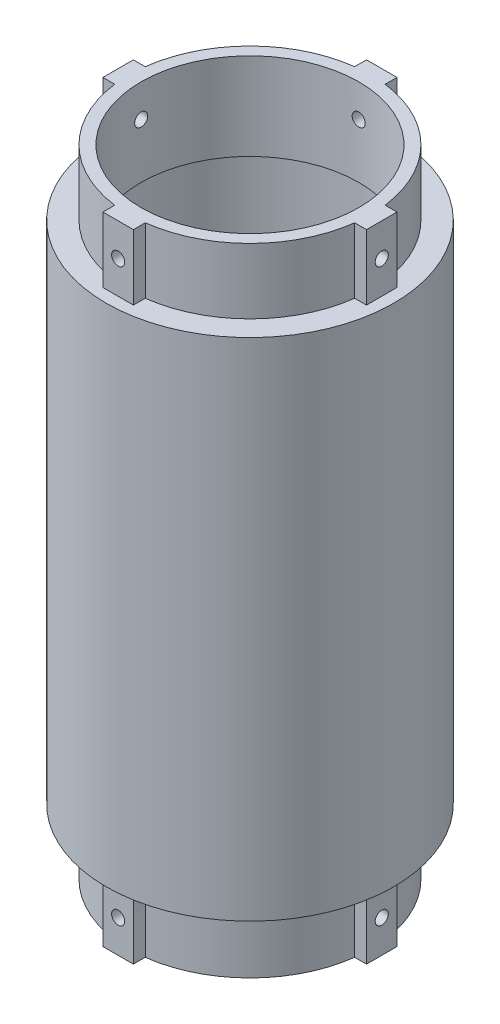
from build123d import *

# Parameters (mm, degrees)
CROQUIS3_R                 = 27.75
CROQUIS3_R_2               = 25
SALIENTE_EXTRUIR1_DEPTH    = 15
CROQUIS4_R                 = 33
CROQUIS4_R_2               = 25
SALIENTE_EXTRUIR2_DEPTH    = 5
CROQUIS5_R                 = 33
CROQUIS5_R_2               = 28
SALIENTE_EXTRUIR3_DEPTH    = 53
CROQUIS6_W                 = 5
CROQUIS6_H                 = 7
CROQUIS6_W_2               = 7
CROQUIS6_H_2               = 5
SALIENTE_EXTRUIR4_DEPTH    = 15
CROQUIS7_R                 = 1.5
CORTAR_EXTRUIR1_DEPTH      = 163.497884602
CROQUIS8_R                 = 1.5
CORTAR_EXTRUIR2_DEPTH      = 163.497884602
CORTAR_EXTRUIR3_DEPTH      = 163.497884602
CORTAR_EXTRUIR3_DEPTH_BACK = 163.497884602
CROQUIS9_R                 = 1.5
CORTAR_EXTRUIR4_DEPTH      = 163.497884691
CORTAR_EXTRUIR4_DEPTH_BACK = 163.497884691
CROQUIS10_R                = 1.5


with BuildPart() as part:
    # Croquis3 → Saliente-Extruir1 (new body)
    with BuildSketch(Plane(origin=(0, 0, 0), x_dir=(1, 0, 0), z_dir=(0, 1, 0))):
        with Locations(Location((0, 0, 0), (0, 0, 270))):
            Circle(CROQUIS3_R)
        with Locations(Location((0, 0, 0), (0, 0, 270))):
            Circle(CROQUIS3_R_2, mode=Mode.SUBTRACT)
    extrude(amount=SALIENTE_EXTRUIR1_DEPTH)

    # Croquis4 → Saliente-Extruir2 (add)
    with BuildSketch(Plane(origin=(0, 15, 0), x_dir=(1, 0, 0), z_dir=(0, 1, 0))):
        with Locations(Location((0, 0, 0), (0, 0, 270))):
            Circle(CROQUIS4_R)
        with Locations(Location((0, 0, 0), (0, 0, 270))):
            Circle(CROQUIS4_R_2, mode=Mode.SUBTRACT)
    extrude(amount=SALIENTE_EXTRUIR2_DEPTH)

    # Croquis5 → Saliente-Extruir3 (add)
    with BuildSketch(Plane(origin=(0, 20, 0), x_dir=(1, 0, 0), z_dir=(0, 1, 0))):
        with Locations(Location((0, 0, 0), (0, 0, 270))):
            Circle(CROQUIS5_R)
        with Locations(Location((0, 0, 0), (0, 0, 270))):
            Circle(CROQUIS5_R_2, mode=Mode.SUBTRACT)
    extrude(amount=SALIENTE_EXTRUIR3_DEPTH)

    # Croquis6 → Saliente-Extruir4 (add)
    with BuildSketch(Plane.XZ.offset(-15)):
        with Locations((27.75, 0)):
            Rectangle(CROQUIS6_W, CROQUIS6_H)
        with Locations((0, 27.75)):
            Rectangle(CROQUIS6_W_2, CROQUIS6_H_2)
        with Locations((0, -27.75)):
            Rectangle(CROQUIS6_W_2, CROQUIS6_H_2)
        with Locations((-27.75, 0)):
            Rectangle(CROQUIS6_W, CROQUIS6_H)
    extrude(amount=SALIENTE_EXTRUIR4_DEPTH)

    # Simetría2: part across plane


with BuildPart() as part_1:
    add(part.part)
    add(part.part.mirror(Plane.ZX.offset(73)))

    # Croquis7 → Cortar-Extruir1 (cut, through all)
    with BuildSketch(Plane.ZY.offset(30.25)):
        with Locations((0, 7.5)):
            Circle(CROQUIS7_R)
    extrude(amount=-CORTAR_EXTRUIR1_DEPTH, mode=Mode.SUBTRACT)

    # Croquis8 → Cortar-Extruir2 (cut, through all)
    with BuildSketch(Plane(origin=(0, 0, -30.25), x_dir=(-1, 0, 0), z_dir=(0, 0, -1))):
        with Locations((0, 7.5)):
            Circle(CROQUIS8_R)
    extrude(amount=-CORTAR_EXTRUIR2_DEPTH, mode=Mode.SUBTRACT)

    # Croquis9 → Cortar-Extruir3 (cut, two sides: drawn at the far end of the back side and taken through both)
    with BuildSketch(Plane.ZY.offset(30.25).offset(-CORTAR_EXTRUIR3_DEPTH_BACK)):
        with Locations((0, 138.5)):
            Circle(CROQUIS9_R)
    extrude(amount=CORTAR_EXTRUIR3_DEPTH + CORTAR_EXTRUIR3_DEPTH_BACK, mode=Mode.SUBTRACT)

    # Croquis10 → Cortar-Extruir4 (cut, two sides: drawn at the far end of the back side and taken through both)
    with BuildSketch(Plane.XY.offset(30.25).offset(-CORTAR_EXTRUIR4_DEPTH_BACK)):
        with Locations((0, 138.5)):
            Circle(CROQUIS10_R)
    extrude(amount=CORTAR_EXTRUIR4_DEPTH + CORTAR_EXTRUIR4_DEPTH_BACK, mode=Mode.SUBTRACT)


solid = part_1.part
